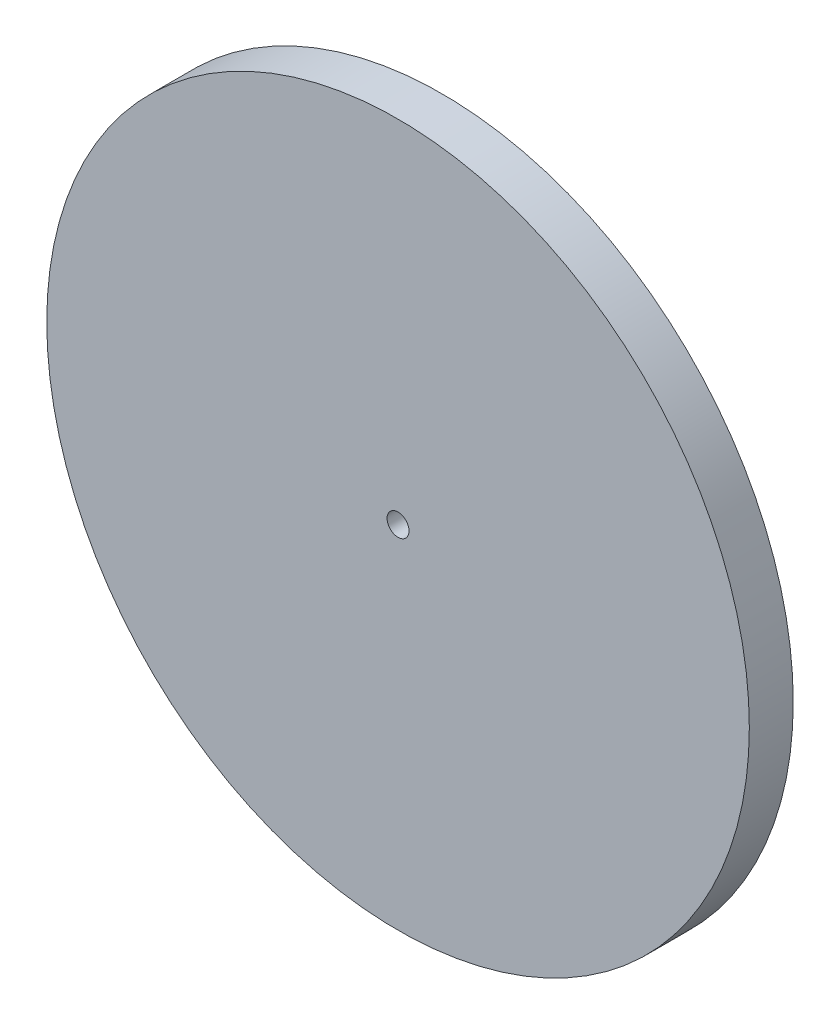
from build123d import *

# Parameters (mm, degrees)
SKETCH_1_R          = 160
EXTRUDE_1_DEPTH     = 10
EXTRUDE_START       = 10
SKETCH_3_R          = 160
SKETCH_3_R_2        = 155
EXTRUDE_1_2_DEPTH   = 10
SKETCH_4_R          = 5
CUT_EXTRUDE_1_DEPTH = 228.156333832


with BuildPart() as part:
    # 草图1 → Extrude 1 (new body)
    with BuildSketch(Plane.XY):
        Circle(SKETCH_1_R)
    extrude(amount=EXTRUDE_1_DEPTH)

    # 草图3 → Extrude 1 2 (add)
    with BuildSketch(Plane(origin=(0, 0, 0), x_dir=(-1, 0, 0), z_dir=(0, 0, -1)).offset(EXTRUDE_START)):
        Circle(SKETCH_3_R)
        Circle(SKETCH_3_R_2, mode=Mode.SUBTRACT)
    extrude(amount=-EXTRUDE_1_2_DEPTH)

    # 草图4 → 切除-拉伸1 (cut, through all)
    with BuildSketch(Plane.XY.offset(10)):
        Circle(SKETCH_4_R)
    extrude(amount=-CUT_EXTRUDE_1_DEPTH, mode=Mode.SUBTRACT)


solid = part.part
